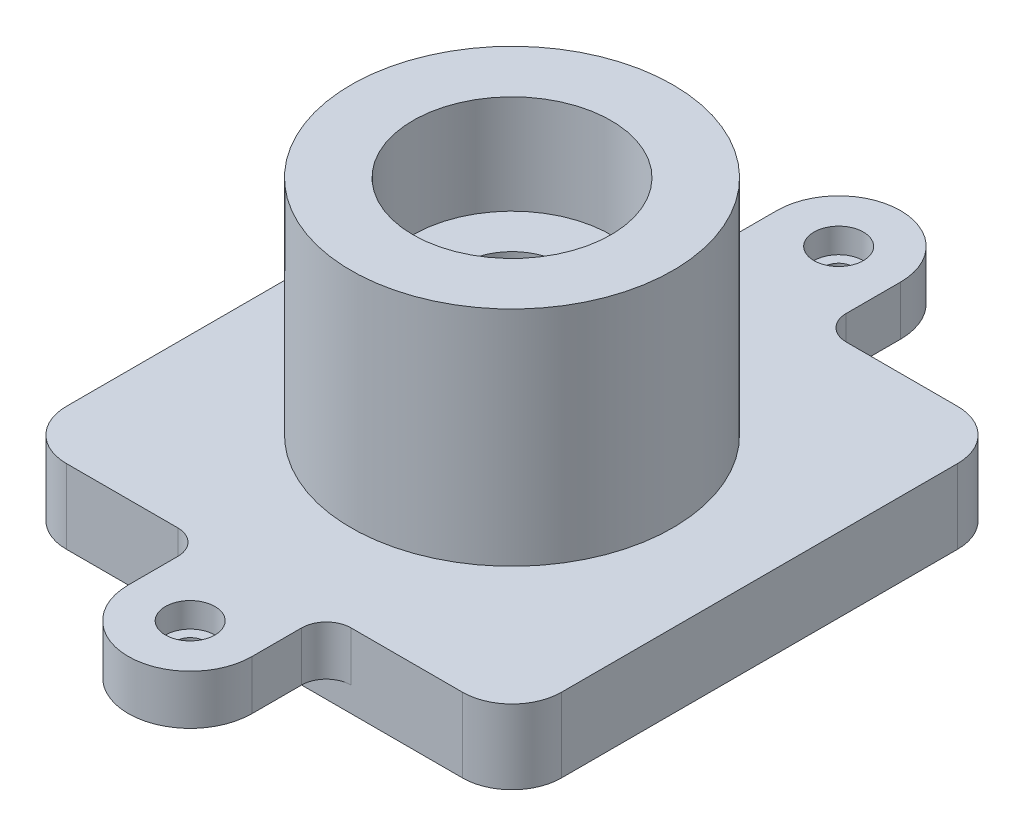
from build123d import *

# Parameters (mm, degrees)
SKETCH1_W                                = 100
SKETCH1_H                                = 100
BOSS_EXTRUDE1_DEPTH                      = 15
BOSS_EXTRUDE2_DEPTH                      = 10
CBORE_FOR_M5_HEX_HEAD_BOLT2_D            = 5.8
CBORE_FOR_M5_HEX_HEAD_BOLT2_CBORE_D      = 10
CBORE_FOR_M5_HEX_HEAD_BOLT2_CBORE_DEPTH  = 5
FILLET1_R                                = 5
FILLET2_R                                = 10
SKETCH11_R                               = 32.5
BOSS_EXTRUDE3_DEPTH                      = 45
CBORE_FOR_M36_HEX_HEAD_BOLT2_D           = 20
CBORE_FOR_M36_HEX_HEAD_BOLT2_CBORE_D     = 40
CBORE_FOR_M36_HEX_HEAD_BOLT2_CBORE_DEPTH = 20


with BuildPart() as part:
    # Sketch1 → Boss-Extrude1 (new body)
    with BuildSketch(Plane(origin=(0, 0, 0), x_dir=(1, 0, 0), z_dir=(0, 1, 0))):
        with Locations((50, 50)):
            Rectangle(SKETCH1_W, SKETCH1_H)
    extrude(amount=BOSS_EXTRUDE1_DEPTH)

    # Sketch3 → Boss-Extrude2 (add)
    with BuildSketch(Plane(origin=(0, 15, 0), x_dir=(1, 0, 0), z_dir=(0, 1, 0))):
        with BuildLine():
            Line((37.5, 100), (37.5, 115.975098948))
            ThreePointArc((37.5, 115.975098948), (50, 128.475098948), (62.5, 115.975098948))
            Line((62.5, 115.975098948), (62.5, 100))
            Line((62.5, 100), (37.5, 100))
        make_face()
        with BuildLine():
            Line((62.5, 0), (62.5, -15))
            ThreePointArc((62.5, -15), (50, -27.5), (37.5, -15))
            Line((37.5, -15), (37.5, 0))
            Line((37.5, 0), (62.5, 0))
        make_face()
    extrude(amount=-BOSS_EXTRUDE2_DEPTH)

    # CBORE for M5 Hex Head Bolt2 (through all)
    with Locations(Plane(origin=(0, 15, 0), x_dir=(1, 0, 0), z_dir=(0, 1, 0))):
        with Locations((50, 115.975098948), (50, -15)):
            CounterBoreHole(CBORE_FOR_M5_HEX_HEAD_BOLT2_D / 2, CBORE_FOR_M5_HEX_HEAD_BOLT2_CBORE_D / 2, CBORE_FOR_M5_HEX_HEAD_BOLT2_CBORE_DEPTH)

    # Fillet1
    fillet1_edges = [part.edges().sort_by_distance(p)[0] for p in [
        (62.5, 10, -100),
        (37.5, 10, -100),
        (37.5, 10, 0),
        (62.5, 10, 0),
    ]]
    fillet(fillet1_edges, radius=FILLET1_R)

    # Fillet2
    fillet2_edges = [part.edges().sort_by_distance(p)[0] for p in [
        (0, 7.5, -100),
        (100, 7.5, -100),
        (100, 7.5, 0),
        (0, 7.5, 0),
    ]]
    fillet(fillet2_edges, radius=FILLET2_R)

    # Sketch11 → Boss-Extrude3 (add)
    with BuildSketch(Plane(origin=(0, 15, 0), x_dir=(1, 0, 0), z_dir=(0, 1, 0))):
        with Locations(Location((50, 50, 0), (0, 0, 90))):
            Circle(SKETCH11_R)
    extrude(amount=BOSS_EXTRUDE3_DEPTH)

    # CBORE for M36 Hex Head Bolt2 (through all)
    with Locations(Plane(origin=(0, 60, 0), x_dir=(1, 0, 0), z_dir=(0, 1, 0))):
        with Locations((50, 50)):
            CounterBoreHole(CBORE_FOR_M36_HEX_HEAD_BOLT2_D / 2, CBORE_FOR_M36_HEX_HEAD_BOLT2_CBORE_D / 2, CBORE_FOR_M36_HEX_HEAD_BOLT2_CBORE_DEPTH)


solid = part.part
